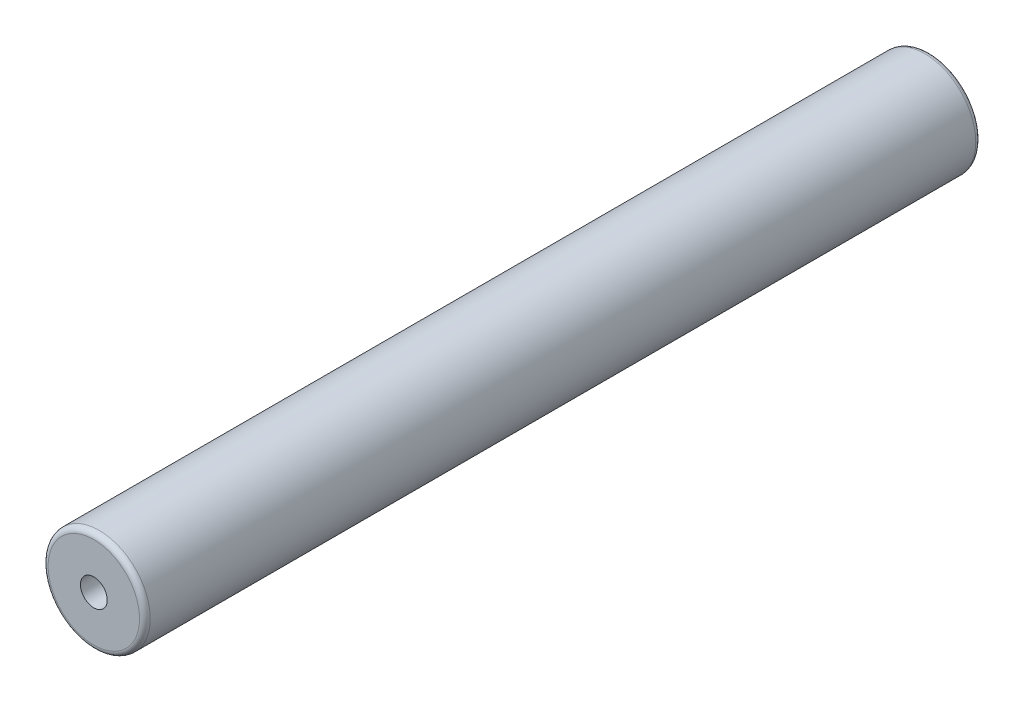
from build123d import *

# Parameters (mm, degrees)
ESBO_O1_R                                      = 4.7625
RESSALTO_EXTRUS_O1_DEPTH                       = 78
FURO_ROSCADO_DE_M3X0_52_D                      = 2.5
FURO_ROSCADO_DE_M3X0_52_DEPTH                  = 8.5
FURO_ROSCADO_DE_M3X0_52_TIP                    = 0.751075774
FILETE1_R                                      = 0.5
BROCA_DE_ROSQUEAR_PARA_TARRAXA_DE_M3X0_5_D     = 2.5
BROCA_DE_ROSQUEAR_PARA_TARRAXA_DE_M3X0_5_DEPTH = 5
BROCA_DE_ROSQUEAR_PARA_TARRAXA_DE_M3X0_5_TIP   = 0.751075774
FILETE2_R                                      = 0.5


with BuildPart() as part:
    # Esboço1 → Ressalto-extrusão1 (new body)
    with BuildSketch(Plane.XY):
        with Locations((240.708388302, 2.596082859)):
            Circle(ESBO_O1_R)
    extrude(amount=RESSALTO_EXTRUS_O1_DEPTH)

    # Furo roscado de M3x0.52
    with Locations(Plane(origin=(0, 0, 0), x_dir=(-1, 0, 0), z_dir=(0, 0, -1))):
        with Locations((-240.708388302, 2.596082859)):
            Hole(FURO_ROSCADO_DE_M3X0_52_D / 2, depth=FURO_ROSCADO_DE_M3X0_52_DEPTH)
            with Locations((0, 0, -(FURO_ROSCADO_DE_M3X0_52_DEPTH + FURO_ROSCADO_DE_M3X0_52_TIP / 2))):  # 118° drill point
                Cone(0, FURO_ROSCADO_DE_M3X0_52_D / 2, FURO_ROSCADO_DE_M3X0_52_TIP, mode=Mode.SUBTRACT)

    # Filete1
    filete1_edges = [part.edges().sort_by_distance(p)[0] for p in [
        (235.945888302, 2.596082859, 0),
    ]]
    fillet(filete1_edges, radius=FILETE1_R)

    # Broca de rosquear para tarraxa de M3x0.51
    with Locations(Plane.XY.offset(78)):
        with Locations((240.708388302, 2.596082859)):
            Hole(BROCA_DE_ROSQUEAR_PARA_TARRAXA_DE_M3X0_5_D / 2, depth=BROCA_DE_ROSQUEAR_PARA_TARRAXA_DE_M3X0_5_DEPTH)
            with Locations((0, 0, -(BROCA_DE_ROSQUEAR_PARA_TARRAXA_DE_M3X0_5_DEPTH + BROCA_DE_ROSQUEAR_PARA_TARRAXA_DE_M3X0_5_TIP / 2))):  # 118° drill point
                Cone(0, BROCA_DE_ROSQUEAR_PARA_TARRAXA_DE_M3X0_5_D / 2, BROCA_DE_ROSQUEAR_PARA_TARRAXA_DE_M3X0_5_TIP, mode=Mode.SUBTRACT)

    # Filete2
    filete2_edges = [part.edges().sort_by_distance(p)[0] for p in [
        (235.945888302, 2.596082859, 78),
    ]]
    fillet(filete2_edges, radius=FILETE2_R)


solid = part.part
